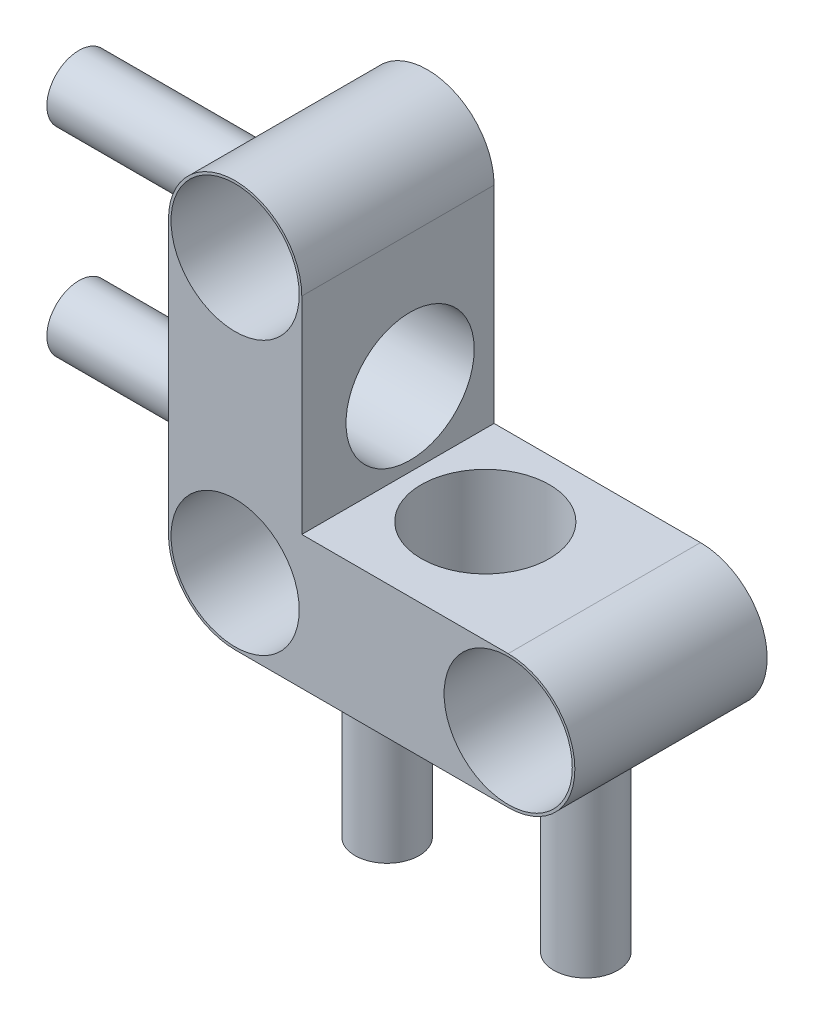
from build123d import *

# Parameters (mm, degrees)
SKETCH1_R                = 0.52
SKETCH1_R_2              = 0.5
BOSS_EXTRUDE1_DEPTH      = 1.5
SKETCH2_R                = 0.5
CUT_EXTRUDE12_DEPTH      = 2
CUT_EXTRUDE14_DEPTH      = 4
CUT_EXTRUDE14_DEPTH_BACK = 2
SKETCH3_R                = 0.5
SKETCH5_R                = 0.25
BOSS_EXTRUDE2_DEPTH      = 1.5
SKETCH6_R                = 0.25
BOSS_EXTRUDE3_DEPTH      = 1.5


with BuildPart() as part:
    # Sketch1 → Boss-Extrude1 (new body)
    # profile 1 of 4: a face of its own
    with BuildSketch(Plane.XY):
        with BuildLine():
            ThreePointArc((0.52, 2.13), (0, 1.61), (-0.52, 2.13))
            Line((-0.52, 2.13), (-0.52, 0))
            ThreePointArc((-0.52, 0), (0, 0.52), (0.52, 0))
            ThreePointArc((0.52, 0), (0.367695526, -0.367695526), (0, -0.52))
            Line((0, -0.52), (2.13, -0.52))
            ThreePointArc((2.13, -0.52), (1.61, 0), (2.13, 0.52))
            Line((2.13, 0.52), (0.52, 0.52))
            Line((0.52, 0.52), (0.52, 2.13))
        make_face()
    # profile 2 of 4: a face of its own
    with BuildSketch(Plane.XY):
        with Locations((0, 2.13)):
            Circle(SKETCH1_R)
        with Locations((0, 2.13)):
            Circle(SKETCH1_R_2, mode=Mode.SUBTRACT)
    # profile 3 of 4: a face of its own
    with BuildSketch(Plane.XY):
        Circle(SKETCH1_R)
        Circle(SKETCH1_R_2, mode=Mode.SUBTRACT)
    # profile 4 of 4: a face of its own
    with BuildSketch(Plane.XY):
        with Locations((2.13, 0)):
            Circle(SKETCH1_R)
        with Locations((2.13, 0)):
            Circle(SKETCH1_R_2, mode=Mode.SUBTRACT)
    extrude(amount=BOSS_EXTRUDE1_DEPTH)

    # Sketch2 → Cut-Extrude12 (cut)
    with BuildSketch(Plane(origin=(0.52, 0, 0), x_dir=(0, 0, -1), z_dir=(1, 0, 0))):
        with Locations((-0.655033029, 1.098813184)):
            Circle(SKETCH2_R)
    extrude(amount=-CUT_EXTRUDE12_DEPTH, mode=Mode.SUBTRACT)

    # Sketch3 → Cut-Extrude14 (cut, two sides: drawn at the far end of the back side and taken through both)
    with BuildSketch(Plane(origin=(0, 0, 0), x_dir=(1, 0, 0), z_dir=(0, 1, 0)).offset(-CUT_EXTRUDE14_DEPTH_BACK)):
        with Locations(Location((1.149294437, -0.697720254, 0), (0, 0, 270))):
            Circle(SKETCH3_R)
    extrude(amount=CUT_EXTRUDE14_DEPTH + CUT_EXTRUDE14_DEPTH_BACK, mode=Mode.SUBTRACT)

    # Sketch5 → Boss-Extrude2 (add)
    with BuildSketch(Plane.ZY.offset(0.52)):
        with Locations(Location((0.698589711, 1.869412016, 0), (0, 0, 90))):
            Circle(SKETCH5_R)
        with Locations(Location((0.698589711, 0.313992931, 0), (0, 0, 90))):
            Circle(SKETCH5_R)
    extrude(amount=BOSS_EXTRUDE2_DEPTH)

    # Sketch6 → Boss-Extrude3 (add)
    with BuildSketch(Plane.XZ.offset(0.52)):
        with Locations(Location((1.90772148, 0.672279594, 0), (0, 0, 27.23786694))):
            Circle(SKETCH6_R)
        with Locations(Location((0.35772148, 0.672279594, 0), (0, 0, 90))):
            Circle(SKETCH6_R)
    extrude(amount=BOSS_EXTRUDE3_DEPTH)


solid = part.part
